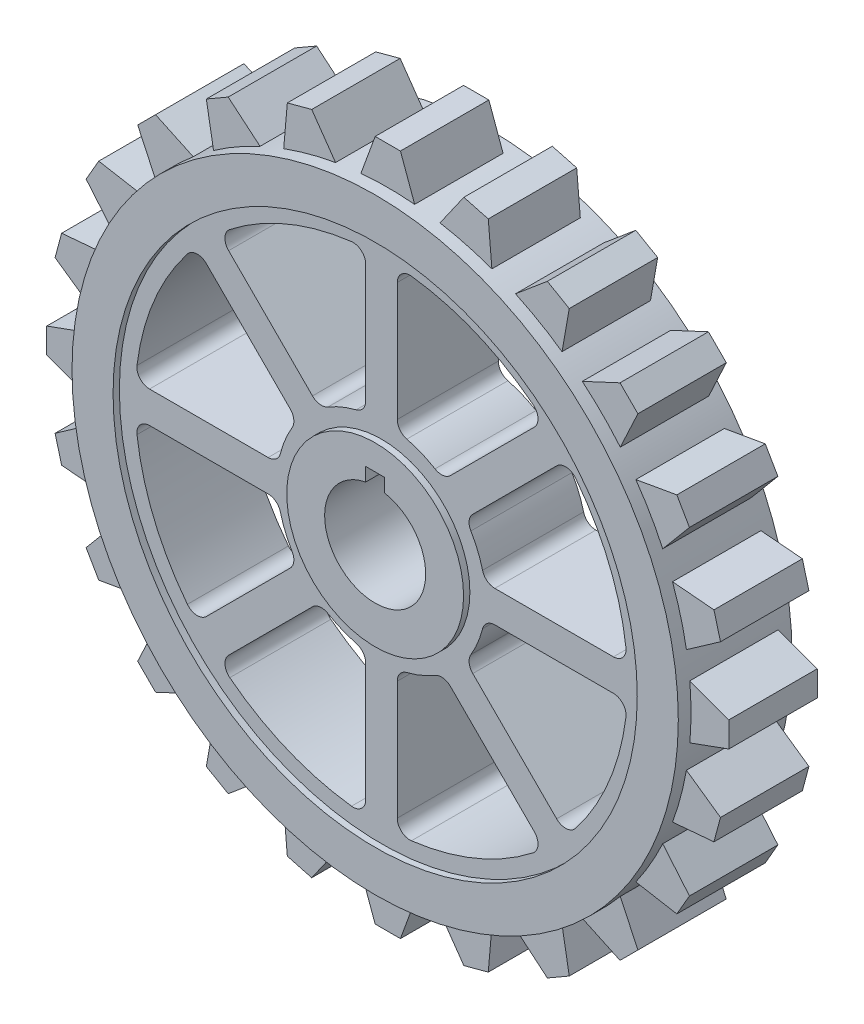
from build123d import *

# Parameters (mm, degrees)
SKETCH1_R           = 14
BOSS_EXTRUDE1_DEPTH = 9
SKETCH1_3_R         = 41.5
SKETCH1_3_R_2       = 14
BOSS_EXTRUDE2_DEPTH = 8
SKETCH1_4_R         = 41.5
BOSS_EXTRUDE3_DEPTH = 9
BOSS_EXTRUDE4_DEPTH = 7


with BuildPart() as part:
    # Sketch1 → Boss-Extrude1 (new, symmetric)
    with BuildSketch(Plane.XY):
        Circle(SKETCH1_R)
        with BuildLine():
            Line((-1.5, 7.858116823), (-1.5, 10))
            Line((-1.5, 10), (1.5, 10))
            Line((1.5, 10), (1.5, 7.858116823))
            ThreePointArc((1.5, 7.858116823), (0, -8), (-1.5, 7.858116823))
        make_face(mode=Mode.SUBTRACT)
    extrude(amount=BOSS_EXTRUDE1_DEPTH, both=True)

    # Sketch1<3> → Boss-Extrude2 (add, symmetric)
    with BuildSketch(Plane.XY):
        Circle(SKETCH1_3_R)
        with BuildLine():
            Line((-2.5, -17.944358445), (-2.5, -36.725331857))
            ThreePointArc((-2.5, -36.725331857), (-3.174572991, -38.223077911), (-4.743243243, -38.71048493))
            ThreePointArc((-4.743243243, -38.71048493), (-14.924653862, -36.031301768), (-24.018466935, -30.726425859))
            ThreePointArc((-24.018466935, -30.726425859), (-24.7830355, -29.272559678), (-24.200964244, -27.73649815))
            Line((-24.200964244, -27.73649815), (-10.920810587, -14.456344493))
            ThreePointArc((-10.920810587, -14.456344493), (-9.751687534, -13.885632203), (-8.478856806, -14.15482205))
            ThreePointArc((-8.478856806, -14.15482205), (-6.314276634, -15.244012286), (-4.013513514, -16.004427802))
            ThreePointArc((-4.013513514, -16.004427802), (-2.923140309, -16.714109074), (-2.5, -17.944358445))
        make_face(mode=Mode.SUBTRACT)
        with BuildLine():
            Line((-14.456344493, -10.920810587), (-27.73649815, -24.200964244))
            ThreePointArc((-27.73649815, -24.200964244), (-29.272559678, -24.7830355), (-30.726425859, -24.018466935))
            ThreePointArc((-30.726425859, -24.018466935), (-36.031301768, -14.924653862), (-38.71048493, -4.743243243))
            ThreePointArc((-38.71048493, -4.743243243), (-38.223077911, -3.174572991), (-36.725331857, -2.5))
            Line((-36.725331857, -2.5), (-17.944358445, -2.5))
            ThreePointArc((-17.944358445, -2.5), (-16.714109074, -2.923140309), (-16.004427802, -4.013513514))
            ThreePointArc((-16.004427802, -4.013513514), (-15.244012286, -6.314276634), (-14.15482205, -8.478856806))
            ThreePointArc((-14.15482205, -8.478856806), (-13.885632203, -9.751687534), (-14.456344493, -10.920810587))
        make_face(mode=Mode.SUBTRACT)
        with BuildLine():
            Line((10.920810587, -14.456344493), (24.200964244, -27.73649815))
            ThreePointArc((24.200964244, -27.73649815), (24.7830355, -29.272559678), (24.018466935, -30.726425859))
            ThreePointArc((24.018466935, -30.726425859), (14.924653862, -36.031301768), (4.743243243, -38.71048493))
            ThreePointArc((4.743243243, -38.71048493), (3.174572991, -38.223077911), (2.5, -36.725331857))
            Line((2.5, -36.725331857), (2.5, -17.944358445))
            ThreePointArc((2.5, -17.944358445), (2.923140309, -16.714109074), (4.013513514, -16.004427802))
            ThreePointArc((4.013513514, -16.004427802), (6.314276634, -15.244012286), (8.478856806, -14.15482205))
            ThreePointArc((8.478856806, -14.15482205), (9.751687534, -13.885632203), (10.920810587, -14.456344493))
        make_face(mode=Mode.SUBTRACT)
        with BuildLine():
            Line((17.944358445, -2.5), (36.725331857, -2.5))
            ThreePointArc((36.725331857, -2.5), (38.223077911, -3.174572991), (38.71048493, -4.743243243))
            ThreePointArc((38.71048493, -4.743243243), (36.031301768, -14.924653862), (30.726425859, -24.018466935))
            ThreePointArc((30.726425859, -24.018466935), (29.272559678, -24.7830355), (27.73649815, -24.200964244))
            Line((27.73649815, -24.200964244), (14.456344493, -10.920810587))
            ThreePointArc((14.456344493, -10.920810587), (13.885632203, -9.751687534), (14.15482205, -8.478856806))
            ThreePointArc((14.15482205, -8.478856806), (15.244012286, -6.314276634), (16.004427802, -4.013513514))
            ThreePointArc((16.004427802, -4.013513514), (16.714109074, -2.923140309), (17.944358445, -2.5))
        make_face(mode=Mode.SUBTRACT)
        Circle(SKETCH1_3_R_2, mode=Mode.SUBTRACT)
        with BuildLine():
            Line((-17.944358445, 2.5), (-36.725331857, 2.5))
            ThreePointArc((-36.725331857, 2.5), (-38.223077911, 3.174572991), (-38.71048493, 4.743243243))
            ThreePointArc((-38.71048493, 4.743243243), (-36.031301768, 14.924653862), (-30.726425859, 24.018466935))
            ThreePointArc((-30.726425859, 24.018466935), (-29.272559678, 24.7830355), (-27.73649815, 24.200964244))
            Line((-27.73649815, 24.200964244), (-14.456344493, 10.920810587))
            ThreePointArc((-14.456344493, 10.920810587), (-13.885632203, 9.751687534), (-14.15482205, 8.478856806))
            ThreePointArc((-14.15482205, 8.478856806), (-15.244012286, 6.314276634), (-16.004427802, 4.013513514))
            ThreePointArc((-16.004427802, 4.013513514), (-16.714109074, 2.923140309), (-17.944358445, 2.5))
        make_face(mode=Mode.SUBTRACT)
        with BuildLine():
            Line((-10.920810587, 14.456344493), (-24.200964244, 27.73649815))
            ThreePointArc((-24.200964244, 27.73649815), (-24.7830355, 29.272559678), (-24.018466935, 30.726425859))
            ThreePointArc((-24.018466935, 30.726425859), (-14.924653862, 36.031301768), (-4.743243243, 38.71048493))
            ThreePointArc((-4.743243243, 38.71048493), (-3.174572991, 38.223077911), (-2.5, 36.725331857))
            Line((-2.5, 36.725331857), (-2.5, 17.944358445))
            ThreePointArc((-2.5, 17.944358445), (-2.923140309, 16.714109074), (-4.013513514, 16.004427802))
            ThreePointArc((-4.013513514, 16.004427802), (-6.314276634, 15.244012286), (-8.478856806, 14.15482205))
            ThreePointArc((-8.478856806, 14.15482205), (-9.751687534, 13.885632203), (-10.920810587, 14.456344493))
        make_face(mode=Mode.SUBTRACT)
        with BuildLine():
            Line((14.456344493, 10.920810587), (27.73649815, 24.200964244))
            ThreePointArc((27.73649815, 24.200964244), (29.272559678, 24.7830355), (30.726425859, 24.018466935))
            ThreePointArc((30.726425859, 24.018466935), (36.031301768, 14.924653862), (38.71048493, 4.743243243))
            ThreePointArc((38.71048493, 4.743243243), (38.223077911, 3.174572991), (36.725331857, 2.5))
            Line((36.725331857, 2.5), (17.944358445, 2.5))
            ThreePointArc((17.944358445, 2.5), (16.714109074, 2.923140309), (16.004427802, 4.013513514))
            ThreePointArc((16.004427802, 4.013513514), (15.244012286, 6.314276634), (14.15482205, 8.478856806))
            ThreePointArc((14.15482205, 8.478856806), (13.885632203, 9.751687534), (14.456344493, 10.920810587))
        make_face(mode=Mode.SUBTRACT)
        with BuildLine():
            Line((2.5, 17.944358445), (2.5, 36.725331857))
            ThreePointArc((2.5, 36.725331857), (3.174572991, 38.223077911), (4.743243243, 38.71048493))
            ThreePointArc((4.743243243, 38.71048493), (14.924653862, 36.031301768), (24.018466935, 30.726425859))
            ThreePointArc((24.018466935, 30.726425859), (24.7830355, 29.272559678), (24.200964244, 27.73649815))
            Line((24.200964244, 27.73649815), (10.920810587, 14.456344493))
            ThreePointArc((10.920810587, 14.456344493), (9.751687534, 13.885632203), (8.478856806, 14.15482205))
            ThreePointArc((8.478856806, 14.15482205), (6.314276634, 15.244012286), (4.013513514, 16.004427802))
            ThreePointArc((4.013513514, 16.004427802), (2.923140309, 16.714109074), (2.5, 17.944358445))
        make_face(mode=Mode.SUBTRACT)
    extrude(amount=BOSS_EXTRUDE2_DEPTH, both=True)

    # Sketch1<4> → Boss-Extrude3 (add, symmetric)
    with BuildSketch(Plane.XY):
        with BuildLine():
            ThreePointArc((4.252519055, 47.81125476), (0, 48), (-4.252519055, 47.81125476))
            ThreePointArc((-4.252519055, 47.81125476), (-6.265257227, 47.589353346), (-8.26684532, 47.282758681))
            ThreePointArc((-8.26684532, 47.282758681), (-12.423314165, 46.364439662), (-16.482081284, 45.081492838))
            ThreePointArc((-16.482081284, 45.081492838), (-18.368804754, 44.346217561), (-20.222837848, 43.532020736))
            ThreePointArc((-20.222837848, 43.532020736), (-24, 41.569219382), (-27.588416911, 39.279501681))
            ThreePointArc((-27.588416911, 39.279501681), (-29.220548592, 38.080960334), (-30.800677397, 36.814647518))
            ThreePointArc((-30.800677397, 36.814647518), (-33.941125497, 33.941125497), (-36.814647518, 30.800677397))
            ThreePointArc((-36.814647518, 30.800677397), (-38.080960334, 29.220548592), (-39.279501681, 27.588416911))
            ThreePointArc((-39.279501681, 27.588416911), (-41.569219382, 24), (-43.532020736, 20.222837848))
            ThreePointArc((-43.532020736, 20.222837848), (-44.346217561, 18.368804754), (-45.081492838, 16.482081284))
            ThreePointArc((-45.081492838, 16.482081284), (-46.364439662, 12.423314165), (-47.282758681, 8.26684532))
            ThreePointArc((-47.282758681, 8.26684532), (-47.589353346, 6.265257227), (-47.81125476, 4.252519055))
            ThreePointArc((-47.81125476, 4.252519055), (-48, 0), (-47.81125476, -4.252519055))
            ThreePointArc((-47.81125476, -4.252519055), (-47.589353346, -6.265257227), (-47.282758681, -8.26684532))
            ThreePointArc((-47.282758681, -8.26684532), (-46.364439662, -12.423314165), (-45.081492838, -16.482081284))
            ThreePointArc((-45.081492838, -16.482081284), (-44.346217561, -18.368804754), (-43.532020736, -20.222837848))
            ThreePointArc((-43.532020736, -20.222837848), (-41.569219382, -24), (-39.279501681, -27.588416911))
            ThreePointArc((-39.279501681, -27.588416911), (-38.080960334, -29.220548592), (-36.814647518, -30.800677397))
            ThreePointArc((-36.814647518, -30.800677397), (-33.941125497, -33.941125497), (-30.800677397, -36.814647518))
            ThreePointArc((-30.800677397, -36.814647518), (-29.220548592, -38.080960334), (-27.588416911, -39.279501681))
            ThreePointArc((-27.588416911, -39.279501681), (-24, -41.569219382), (-20.222837848, -43.532020736))
            ThreePointArc((-20.222837848, -43.532020736), (-18.368804754, -44.346217561), (-16.482081284, -45.081492838))
            ThreePointArc((-16.482081284, -45.081492838), (-12.423314165, -46.364439662), (-8.26684532, -47.282758681))
            ThreePointArc((-8.26684532, -47.282758681), (-6.265257227, -47.589353346), (-4.252519055, -47.81125476))
            ThreePointArc((-4.252519055, -47.81125476), (0, -48), (4.252519055, -47.81125476))
            ThreePointArc((4.252519055, -47.81125476), (6.265257227, -47.589353346), (8.26684532, -47.282758681))
            ThreePointArc((8.26684532, -47.282758681), (12.423314165, -46.364439662), (16.482081284, -45.081492838))
            ThreePointArc((16.482081284, -45.081492838), (18.368804754, -44.346217561), (20.222837848, -43.532020736))
            ThreePointArc((20.222837848, -43.532020736), (24, -41.569219382), (27.588416911, -39.279501681))
            ThreePointArc((27.588416911, -39.279501681), (29.220548592, -38.080960334), (30.800677397, -36.814647518))
            ThreePointArc((30.800677397, -36.814647518), (33.941125497, -33.941125497), (36.814647518, -30.800677397))
            ThreePointArc((36.814647518, -30.800677397), (38.080960334, -29.220548592), (39.279501681, -27.588416911))
            ThreePointArc((39.279501681, -27.588416911), (41.569219382, -24), (43.532020736, -20.222837848))
            ThreePointArc((43.532020736, -20.222837848), (44.346217561, -18.368804754), (45.081492838, -16.482081284))
            ThreePointArc((45.081492838, -16.482081284), (46.364439662, -12.423314165), (47.282758681, -8.26684532))
            ThreePointArc((47.282758681, -8.26684532), (47.589353346, -6.265257227), (47.81125476, -4.252519055))
            ThreePointArc((47.81125476, -4.252519055), (47.952790474, -2.12835283), (48, 0))
            ThreePointArc((48, 0), (47.952790474, 2.12835283), (47.81125476, 4.252519055))
            ThreePointArc((47.81125476, 4.252519055), (47.589353346, 6.265257227), (47.282758681, 8.26684532))
            ThreePointArc((47.282758681, 8.26684532), (46.364439662, 12.423314165), (45.081492838, 16.482081284))
            ThreePointArc((45.081492838, 16.482081284), (44.346217561, 18.368804754), (43.532020736, 20.222837848))
            ThreePointArc((43.532020736, 20.222837848), (41.569219382, 24), (39.279501681, 27.588416911))
            ThreePointArc((39.279501681, 27.588416911), (38.080960334, 29.220548592), (36.814647518, 30.800677397))
            ThreePointArc((36.814647518, 30.800677397), (33.941125497, 33.941125497), (30.800677397, 36.814647518))
            ThreePointArc((30.800677397, 36.814647518), (29.220548592, 38.080960334), (27.588416911, 39.279501681))
            ThreePointArc((27.588416911, 39.279501681), (24, 41.569219382), (20.222837848, 43.532020736))
            ThreePointArc((20.222837848, 43.532020736), (18.368804754, 44.346217561), (16.482081284, 45.081492838))
            ThreePointArc((16.482081284, 45.081492838), (12.423314165, 46.364439662), (8.26684532, 47.282758681))
            ThreePointArc((8.26684532, 47.282758681), (6.265257227, 47.589353346), (4.252519055, 47.81125476))
        make_face()
        Circle(SKETCH1_4_R, mode=Mode.SUBTRACT)
    extrude(amount=BOSS_EXTRUDE3_DEPTH, both=True)

    # Sketch1<5> → Boss-Extrude4 (add, symmetric)
    with BuildSketch(Plane.XY):
        with BuildLine():
            Line((2, 54), (-2, 54))
            Line((-2, 54), (-4.252519055, 47.81125476))
            ThreePointArc((-4.252519055, 47.81125476), (0, 48), (4.252519055, 47.81125476))
            Line((4.252519055, 47.81125476), (2, 54))
        make_face()
        with BuildLine():
            ThreePointArc((-16.482081284, 45.081492838), (-12.423314165, 46.364439662), (-8.26684532, 47.282758681))
            Line((-8.26684532, 47.282758681), (-12.044376783, 52.67763271))
            Line((-12.044376783, 52.67763271), (-15.908080088, 51.642356529))
            Line((-15.908080088, 51.642356529), (-16.482081284, 45.081492838))
        make_face()
        with BuildLine():
            Line((12.044376783, 52.67763271), (8.26684532, 47.282758681))
            ThreePointArc((8.26684532, 47.282758681), (12.423314165, 46.364439662), (16.482081284, 45.081492838))
            Line((16.482081284, 45.081492838), (15.908080088, 51.642356529))
            Line((15.908080088, 51.642356529), (12.044376783, 52.67763271))
        make_face()
        with BuildLine():
            ThreePointArc((-27.588416911, 39.279501681), (-24, 41.569219382), (-20.222837848, 43.532020736))
            Line((-20.222837848, 43.532020736), (-25.267949192, 47.765371804))
            Line((-25.267949192, 47.765371804), (-28.732050808, 45.765371804))
            Line((-28.732050808, 45.765371804), (-27.588416911, 39.279501681))
        make_face()
        with BuildLine():
            Line((25.267949192, 47.765371804), (20.222837848, 43.532020736))
            ThreePointArc((20.222837848, 43.532020736), (24, 41.569219382), (27.588416911, 39.279501681))
            Line((27.588416911, 39.279501681), (28.732050808, 45.765371804))
            Line((28.732050808, 45.765371804), (25.267949192, 47.765371804))
        make_face()
        with BuildLine():
            ThreePointArc((-36.814647518, 30.800677397), (-33.941125497, 33.941125497), (-30.800677397, 36.814647518))
            Line((-30.800677397, 36.814647518), (-36.769552622, 39.597979746))
            Line((-36.769552622, 39.597979746), (-39.597979746, 36.769552622))
            Line((-39.597979746, 36.769552622), (-36.814647518, 30.800677397))
        make_face()
        with BuildLine():
            Line((36.769552622, 39.597979746), (30.800677397, 36.814647518))
            ThreePointArc((30.800677397, 36.814647518), (33.941125497, 33.941125497), (36.814647518, 30.800677397))
            Line((36.814647518, 30.800677397), (39.597979746, 36.769552622))
            Line((39.597979746, 36.769552622), (36.769552622, 39.597979746))
        make_face()
        with BuildLine():
            ThreePointArc((-43.532020736, 20.222837848), (-41.569219382, 24), (-39.279501681, 27.588416911))
            Line((-39.279501681, 27.588416911), (-45.765371804, 28.732050808))
            Line((-45.765371804, 28.732050808), (-47.765371804, 25.267949192))
            Line((-47.765371804, 25.267949192), (-43.532020736, 20.222837848))
        make_face()
        with BuildLine():
            Line((45.765371804, 28.732050808), (39.279501681, 27.588416911))
            ThreePointArc((39.279501681, 27.588416911), (41.569219382, 24), (43.532020736, 20.222837848))
            Line((43.532020736, 20.222837848), (47.765371804, 25.267949192))
            Line((47.765371804, 25.267949192), (45.765371804, 28.732050808))
        make_face()
        with BuildLine():
            ThreePointArc((-47.282758681, 8.26684532), (-46.364439662, 12.423314165), (-45.081492838, 16.482081284))
            Line((-45.081492838, 16.482081284), (-51.642356529, 15.908080088))
            Line((-51.642356529, 15.908080088), (-52.67763271, 12.044376783))
            Line((-52.67763271, 12.044376783), (-47.282758681, 8.26684532))
        make_face()
        with BuildLine():
            Line((51.642356529, 15.908080088), (45.081492838, 16.482081284))
            ThreePointArc((45.081492838, 16.482081284), (46.364439662, 12.423314165), (47.282758681, 8.26684532))
            Line((47.282758681, 8.26684532), (52.67763271, 12.044376783))
            Line((52.67763271, 12.044376783), (51.642356529, 15.908080088))
        make_face()
        with BuildLine():
            ThreePointArc((-47.81125476, -4.252519055), (-48, 0), (-47.81125476, 4.252519055))
            Line((-47.81125476, 4.252519055), (-54, 2))
            Line((-54, 2), (-54, -2))
            Line((-54, -2), (-47.81125476, -4.252519055))
        make_face()
        with BuildLine():
            Line((54, 2), (47.81125476, 4.252519055))
            ThreePointArc((47.81125476, 4.252519055), (48, 0), (47.81125476, -4.252519055))
            Line((47.81125476, -4.252519055), (54, -2))
            Line((54, -2), (54, 2))
        make_face()
        with BuildLine():
            ThreePointArc((-45.081492838, -16.482081284), (-46.364439662, -12.423314165), (-47.282758681, -8.26684532))
            Line((-47.282758681, -8.26684532), (-52.67763271, -12.044376783))
            Line((-52.67763271, -12.044376783), (-51.642356529, -15.908080088))
            Line((-51.642356529, -15.908080088), (-45.081492838, -16.482081284))
        make_face()
        with BuildLine():
            Line((52.67763271, -12.044376783), (47.282758681, -8.26684532))
            ThreePointArc((47.282758681, -8.26684532), (46.364439662, -12.423314165), (45.081492838, -16.482081284))
            Line((45.081492839, -16.482081284), (51.642356529, -15.908080088))
            Line((51.642356529, -15.908080088), (52.67763271, -12.044376783))
        make_face()
        with BuildLine():
            ThreePointArc((-39.279501681, -27.588416911), (-41.569219382, -24), (-43.532020736, -20.222837848))
            Line((-43.532020736, -20.222837848), (-47.765371804, -25.267949192))
            Line((-47.765371804, -25.267949192), (-45.765371804, -28.732050808))
            Line((-45.765371804, -28.732050808), (-39.279501681, -27.588416911))
        make_face()
        with BuildLine():
            Line((47.765371804, -25.267949192), (43.532020736, -20.222837848))
            ThreePointArc((43.532020736, -20.222837848), (41.569219382, -24), (39.279501681, -27.588416911))
            Line((39.279501681, -27.588416911), (45.765371804, -28.732050808))
            Line((45.765371804, -28.732050808), (47.765371804, -25.267949192))
        make_face()
        with BuildLine():
            ThreePointArc((-30.800677397, -36.814647518), (-33.941125497, -33.941125497), (-36.814647518, -30.800677397))
            Line((-36.814647518, -30.800677397), (-39.597979746, -36.769552622))
            Line((-39.597979746, -36.769552622), (-36.769552622, -39.597979746))
            Line((-36.769552622, -39.597979746), (-30.800677397, -36.814647518))
        make_face()
        with BuildLine():
            Line((39.597979746, -36.769552622), (36.814647518, -30.800677397))
            ThreePointArc((36.814647518, -30.800677397), (33.941125497, -33.941125497), (30.800677397, -36.814647518))
            Line((30.800677397, -36.814647518), (36.769552622, -39.597979746))
            Line((36.769552622, -39.597979746), (39.597979746, -36.769552622))
        make_face()
        with BuildLine():
            ThreePointArc((-20.222837848, -43.532020736), (-24, -41.569219382), (-27.588416911, -39.279501681))
            Line((-27.588416911, -39.279501681), (-28.732050808, -45.765371804))
            Line((-28.732050808, -45.765371804), (-25.267949192, -47.765371804))
            Line((-25.267949192, -47.765371804), (-20.222837848, -43.532020736))
        make_face()
        with BuildLine():
            Line((28.732050808, -45.765371804), (27.588416911, -39.279501681))
            ThreePointArc((27.588416911, -39.279501681), (24, -41.569219382), (20.222837848, -43.532020736))
            Line((20.222837848, -43.532020736), (25.267949192, -47.765371804))
            Line((25.267949192, -47.765371804), (28.732050808, -45.765371804))
        make_face()
        with BuildLine():
            ThreePointArc((-8.26684532, -47.282758681), (-12.423314165, -46.364439662), (-16.482081284, -45.081492838))
            Line((-16.482081284, -45.081492838), (-15.908080088, -51.642356529))
            Line((-15.908080088, -51.642356529), (-12.044376783, -52.67763271))
            Line((-12.044376783, -52.67763271), (-8.26684532, -47.282758681))
        make_face()
        with BuildLine():
            Line((15.908080088, -51.642356529), (16.482081284, -45.081492838))
            ThreePointArc((16.482081284, -45.081492838), (12.423314165, -46.364439662), (8.26684532, -47.282758681))
            Line((8.26684532, -47.282758681), (12.044376783, -52.67763271))
            Line((12.044376783, -52.67763271), (15.908080088, -51.642356529))
        make_face()
        with BuildLine():
            ThreePointArc((4.252519055, -47.81125476), (0, -48), (-4.252519055, -47.81125476))
            Line((-4.252519055, -47.81125476), (-2, -54))
            Line((-2, -54), (2, -54))
            Line((2, -54), (4.252519055, -47.81125476))
        make_face()
    extrude(amount=BOSS_EXTRUDE4_DEPTH, both=True)


solid = part.part
